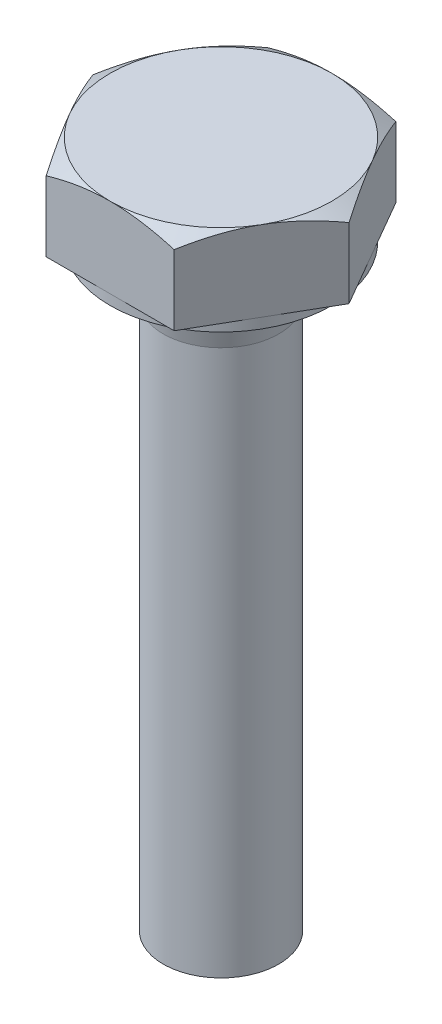
from build123d import *

# Parameters (mm, degrees)
SKIZZE2_OUTSIDE_W               = 26.122
SKIZZE2_OUTSIDE_H               = 26.122
SCHNITT_LINEAR_AUSTRAGEN1_DEPTH = 42.674393343


with BuildPart() as part:
    # Skizze1 → Basis-Rotation (revolve)
    with BuildSketch(Plane.XY, mode=Mode.PRIVATE) as basis_rotation_sk:
        Polygon((0, 5.3), (0, -35), (3.3865, -35), (3.3865, -3), (3.998, -0.002), (4, -0.002), (4, 0), (6.5, 0), (6.5, 0.6), (7.5055, 0.6), (7.5055, 4.719474304), (6.5, 5.3), align=None)
    revolve(basis_rotation_sk.sketch.rotate(Axis((0, 5.3, 0), (0, -1, 0)), 180), axis=Axis((0, 5.3, 0), (0, -1, 0)))

    # Skizze2 outside → Schnitt-Linear austragen1 (cut, through all)
    with BuildSketch(Plane(origin=(0, 5.3, 0), x_dir=(-1, 0, 0), z_dir=(0, 1, 0))):
        Rectangle(SKIZZE2_OUTSIDE_W, SKIZZE2_OUTSIDE_H)
        Polygon((-3.75277675, 6.5), (3.75277675, 6.5), (7.505553499, 0), (3.75277675, -6.5), (-3.75277675, -6.5), (-7.505553499, 0), align=None, mode=Mode.SUBTRACT)
    extrude(amount=-SCHNITT_LINEAR_AUSTRAGEN1_DEPTH, mode=Mode.SUBTRACT)


solid = part.part
